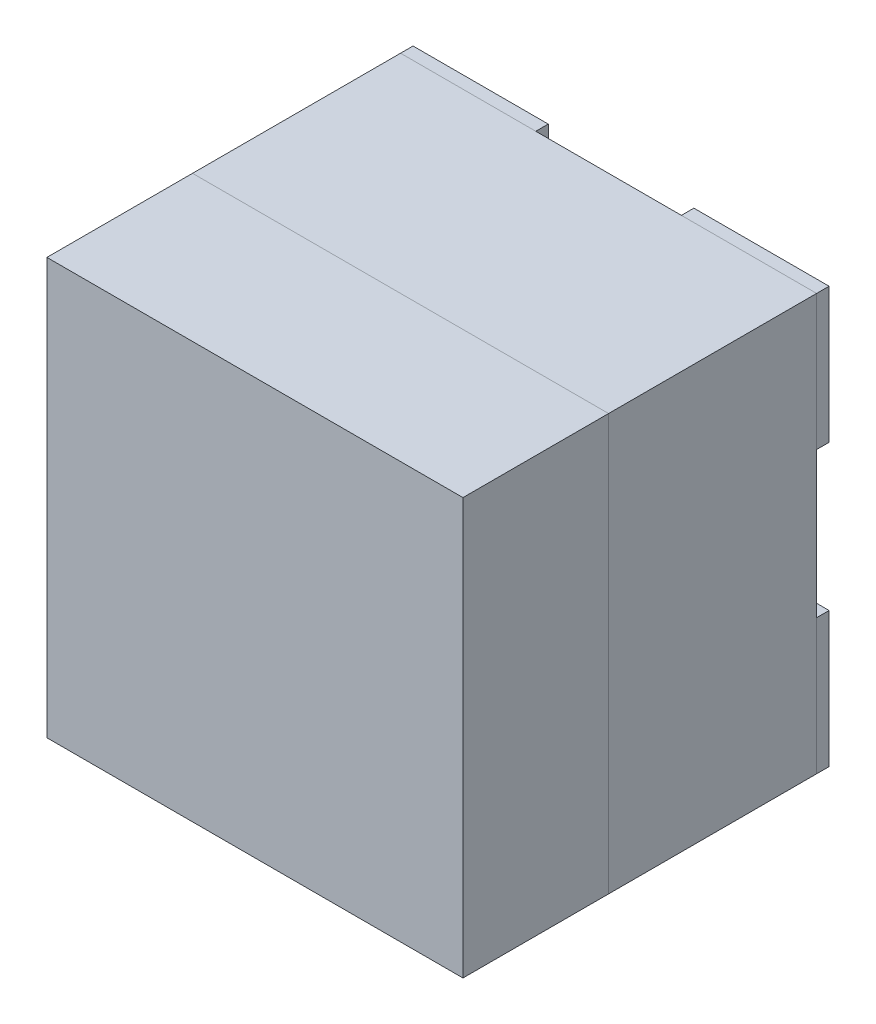
from build123d import *

# Parameters (mm, degrees)
SKIZZE1_W                         = 1
SKIZZE1_H                         = 1
AUFSATZ_LINEAR_AUSTRAGEN1_DEPTH   = 0.5
SKIZZE2_W                         = 0.325
SKIZZE2_H                         = 0.325
AUFSATZ_LINEAR_AUSTRAGEN2_DEPTH   = 0.03
AUFSATZ_LINEAR_AUSTRAGEN2_2_DEPTH = 0.03
AUFSATZ_LINEAR_AUSTRAGEN2_3_DEPTH = 0.03
AUFSATZ_LINEAR_AUSTRAGEN2_4_DEPTH = 0.03
SKIZZE3_W                         = 1
SKIZZE3_H                         = 1
AUFSATZ_LINEAR_AUSTRAGEN3_DEPTH   = 0.35


with BuildPart() as part:
    # Skizze1 → Aufsatz-Linear austragen1 (new body)
    with BuildSketch(Plane.XY):
        Rectangle(SKIZZE1_W, SKIZZE1_H)
    extrude(amount=AUFSATZ_LINEAR_AUSTRAGEN1_DEPTH)


with BuildPart() as body_2:
    # Skizze2 → Aufsatz-Linear austragen2 (new body)
    with BuildSketch(Plane(origin=(0, 0, 0), x_dir=(-1, 0, 0), z_dir=(0, 0, -1))):
        with Locations((-0.3375, 0.3375)):
            Rectangle(SKIZZE2_W, SKIZZE2_H)
    extrude(amount=AUFSATZ_LINEAR_AUSTRAGEN2_DEPTH)


with BuildPart() as body_3:
    # Skizze2 → Aufsatz-Linear austragen2 2 (new body)
    with BuildSketch(Plane(origin=(0, 0, 0), x_dir=(-1, 0, 0), z_dir=(0, 0, -1))):
        with Locations((0.3375, 0.3375)):
            Rectangle(SKIZZE2_W, SKIZZE2_H)
    extrude(amount=AUFSATZ_LINEAR_AUSTRAGEN2_2_DEPTH)


with BuildPart() as body_4:
    # Skizze2 → Aufsatz-Linear austragen2 3 (new body)
    with BuildSketch(Plane(origin=(0, 0, 0), x_dir=(-1, 0, 0), z_dir=(0, 0, -1))):
        with Locations((-0.3375, -0.3375)):
            Rectangle(SKIZZE2_W, SKIZZE2_H)
    extrude(amount=AUFSATZ_LINEAR_AUSTRAGEN2_3_DEPTH)


with BuildPart() as body_5:
    # Skizze2 → Aufsatz-Linear austragen2 4 (new body)
    with BuildSketch(Plane(origin=(0, 0, 0), x_dir=(-1, 0, 0), z_dir=(0, 0, -1))):
        with Locations((0.3375, -0.3375)):
            Rectangle(SKIZZE2_W, SKIZZE2_H)
    extrude(amount=AUFSATZ_LINEAR_AUSTRAGEN2_4_DEPTH)


with BuildPart() as body_6:
    # Skizze3 → Aufsatz-Linear austragen3 (new body)
    with BuildSketch(Plane.XY.offset(0.5)):
        Rectangle(SKIZZE3_W, SKIZZE3_H)
    extrude(amount=AUFSATZ_LINEAR_AUSTRAGEN3_DEPTH)


solid = Compound([part.part, body_2.part, body_3.part, body_4.part, body_5.part, body_6.part])
